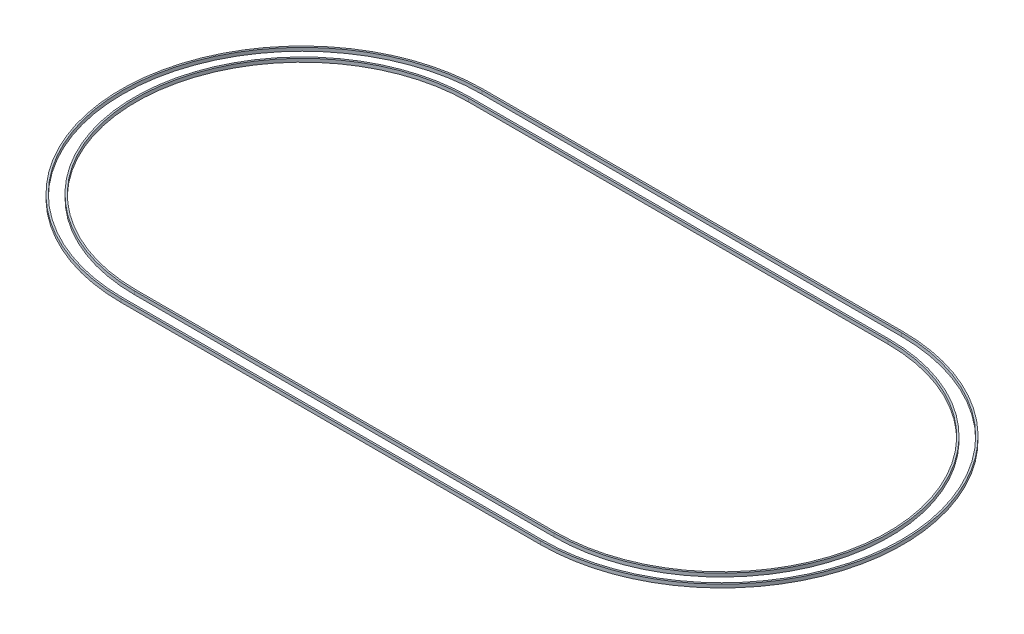
from build123d import *

# Parameters (mm, degrees)
BOSS_EXTRUDE1_DEPTH = 400
BOSS_EXTRUDE2_DEPTH = 400


with BuildPart() as part:
    # Sketch1 → Boss-Extrude1 (new body)
    with BuildSketch(Plane(origin=(0, 0, 0), x_dir=(1, 0, 0), z_dir=(0, 1, 0))):
        with BuildLine():
            ThreePointArc((-25000, 20000), (-45000, 0), (-25000, -20000))
            Line((-25000, -20000), (25000, -20000))
            ThreePointArc((25000, -20000), (45000, 0), (25000, 20000))
            Line((25000, 20000), (-25000, 20000))
        make_face()
        with BuildLine():
            Line((25000, -19800), (-25000, -19800))
            ThreePointArc((-25000, -19800), (-44800, 0), (-25000, 19800))
            Line((-25000, 19800), (25000, 19800))
            ThreePointArc((25000, 19800), (44800, 0), (25000, -19800))
        make_face(mode=Mode.SUBTRACT)
    extrude(amount=BOSS_EXTRUDE1_DEPTH)


with BuildPart() as body_2:
    # Sketch1<6> → Boss-Extrude2 (new body)
    with BuildSketch(Plane(origin=(0, 0, 0), x_dir=(1, 0, 0), z_dir=(0, 1, 0))):
        with BuildLine():
            Line((-25000, -21600), (25000, -21600))
            ThreePointArc((25000, -21600), (46600, 0), (25000, 21600))
            Line((25000, 21600), (-25000, 21600))
            ThreePointArc((-25000, 21600), (-46600, 0), (-25000, -21600))
        make_face()
        with BuildLine():
            Line((-25000, -21400), (25000, -21400))
            ThreePointArc((25000, -21400), (46400, 0), (25000, 21400))
            Line((25000, 21400), (-25000, 21400))
            ThreePointArc((-25000, 21400), (-46400, 0), (-25000, -21400))
        make_face(mode=Mode.SUBTRACT)
    extrude(amount=BOSS_EXTRUDE2_DEPTH)


solid = Compound([part.part, body_2.part])
